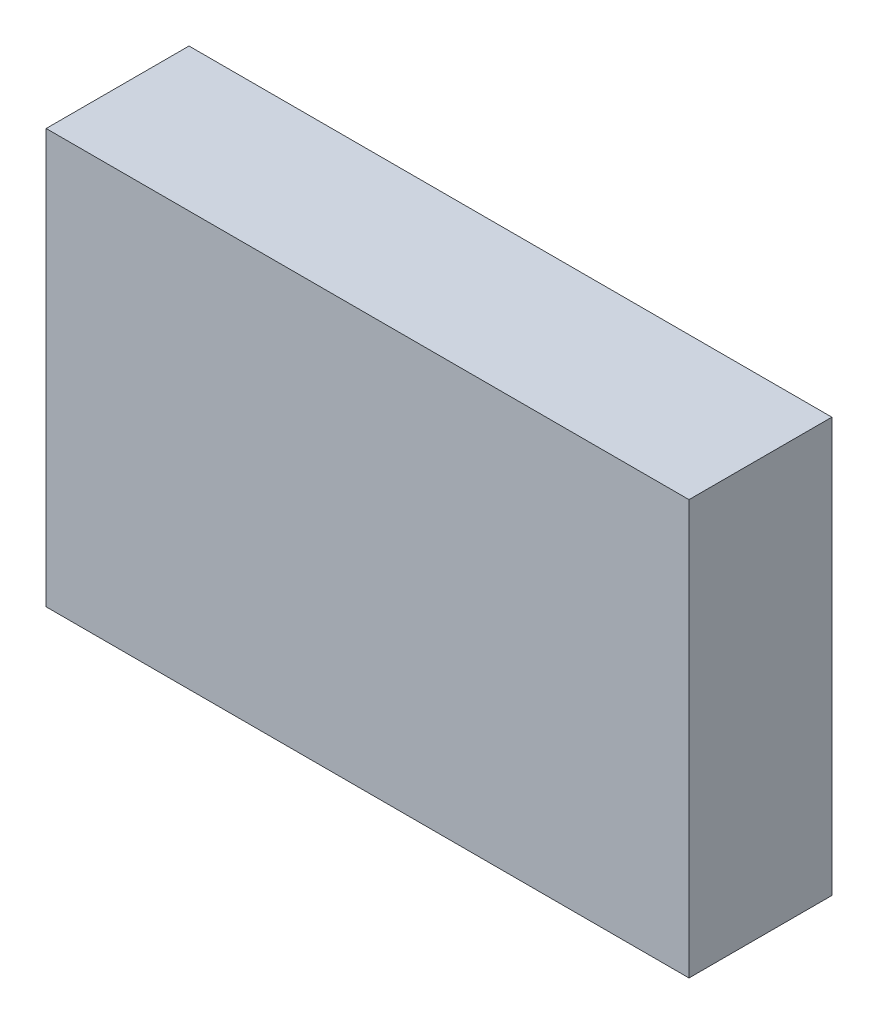
from build123d import *

# Parameters (mm, degrees)
SKETCH1_W           = 45
SKETCH1_H           = 29
BOSS_EXTRUDE1_DEPTH = 10


with BuildPart() as part:
    # Sketch1 → Boss-Extrude1 (new body)
    with BuildSketch(Plane.XY):
        Rectangle(SKETCH1_W, SKETCH1_H)
    extrude(amount=BOSS_EXTRUDE1_DEPTH)


solid = part.part
